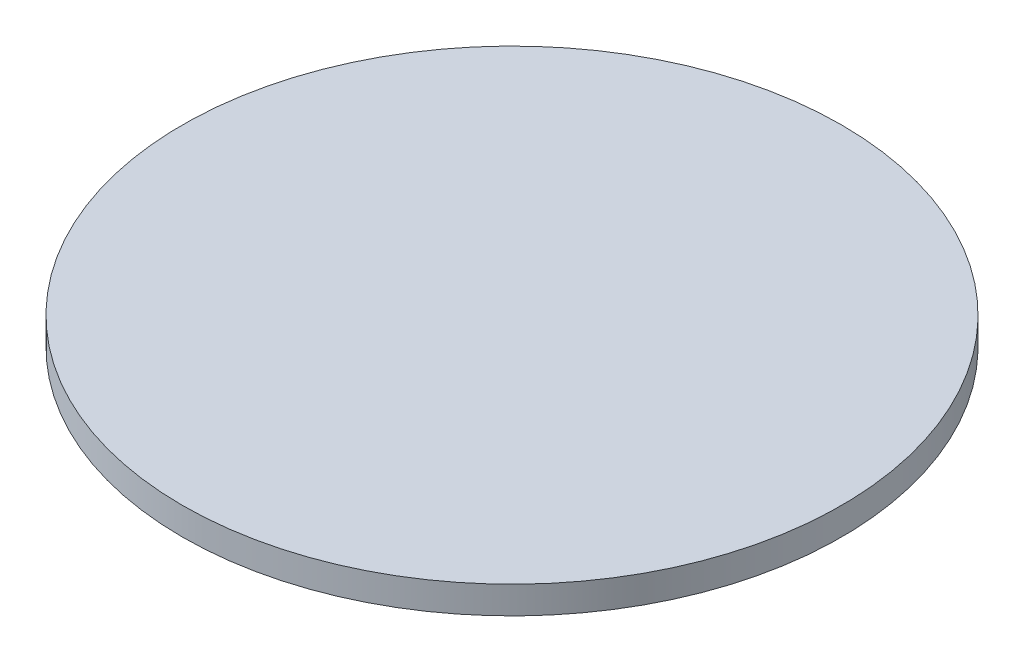
from build123d import *

# Parameters (mm, degrees)
SKETCH1_R           = 38.1
BOSS_EXTRUDE1_DEPTH = 3.175


with BuildPart() as part:
    # Sketch1 → Boss-Extrude1 (new body)
    with BuildSketch(Plane(origin=(0, 0, 0), x_dir=(1, 0, 0), z_dir=(0, 1, 0))):
        with Locations(Location((0, 0, 0), (0, 0, 270))):
            Circle(SKETCH1_R)
    extrude(amount=BOSS_EXTRUDE1_DEPTH)


solid = part.part
